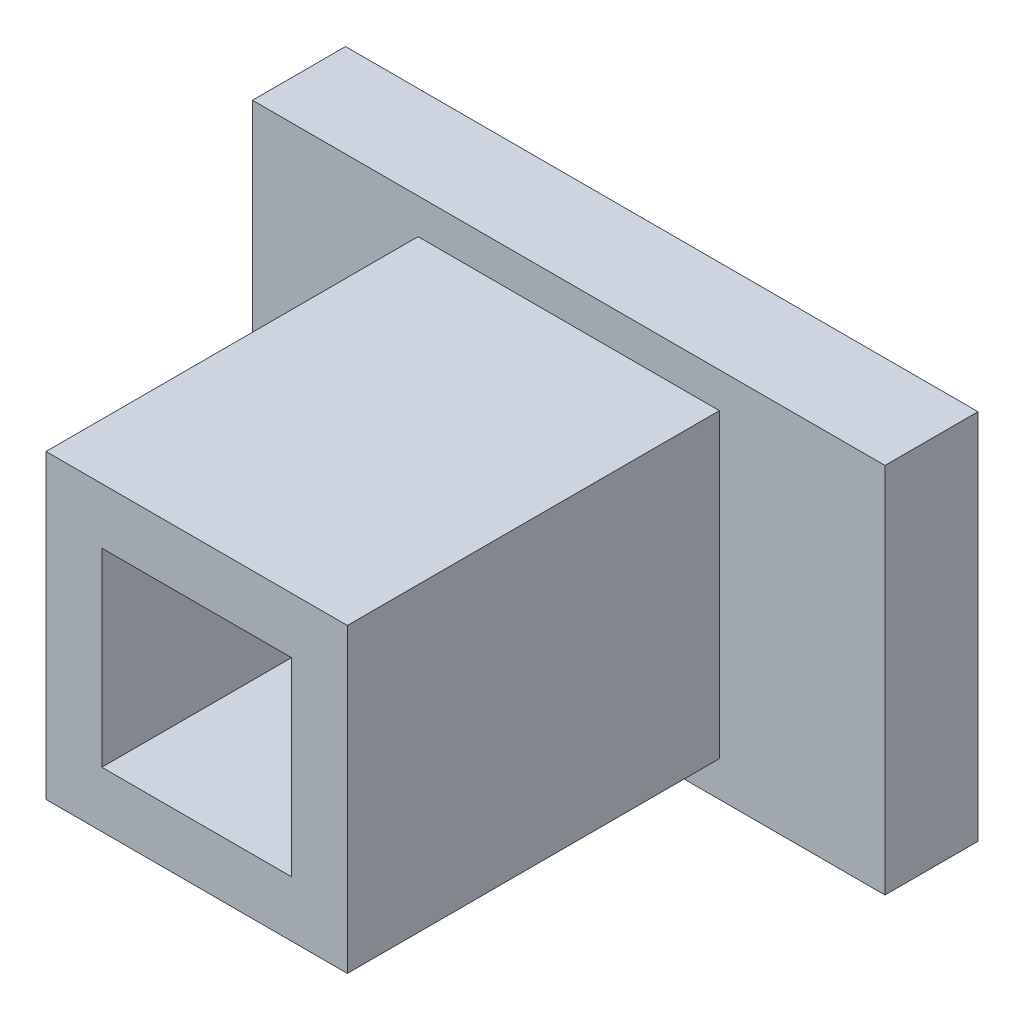
from build123d import *

# Parameters (mm, degrees)
SKETCH_1_W      = 16.2
SKETCH_1_H      = 16.2
SKETCH_1_W_2    = 10.2
SKETCH_1_H_2    = 10.2
EXTRUDE_1_DEPTH = 20
SKETCH_1_6_W    = 34
SKETCH_1_6_H    = 20
EXTRUDE_2_DEPTH = 5


with BuildPart() as part:
    # 草图1 → 凸台-拉伸1 (new body)
    with BuildSketch(Plane.XY):
        Rectangle(SKETCH_1_W, SKETCH_1_H)
        Rectangle(SKETCH_1_W_2, SKETCH_1_H_2, mode=Mode.SUBTRACT)
    extrude(amount=EXTRUDE_1_DEPTH)

    # 草图1<6> → 凸台-拉伸2 (add)
    with BuildSketch(Plane.XY):
        Rectangle(SKETCH_1_6_W, SKETCH_1_6_H)
    extrude(amount=-EXTRUDE_2_DEPTH)


solid = part.part
